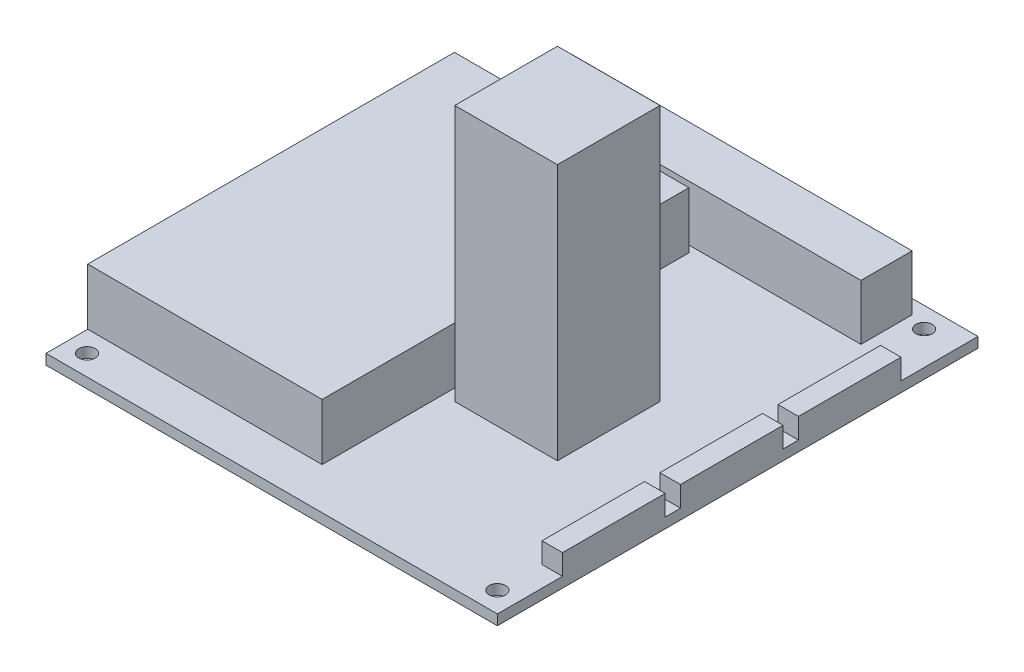
from build123d import *

# Parameters (mm, degrees)
SKETCH3_W           = 88
SKETCH3_H           = 93.7
SKETCH3_R           = 1.6
BOSS_EXTRUDE1_DEPTH = 2
SKETCH4_W           = 45.7
SKETCH4_H           = 71.5
BOSS_EXTRUDE2_DEPTH = 11
SKETCH5_W           = 66.548
SKETCH5_H           = 9.979
BOSS_EXTRUDE3_DEPTH = 10.8
SKETCH6_W           = 20
SKETCH6_H           = 20
BOSS_EXTRUDE4_DEPTH = 50
SKETCH7_W           = 4
SKETCH7_H           = 20
BOSS_EXTRUDE5_DEPTH = 4
SKETCH8_W           = 0.635
SKETCH8_H           = 0.635
BOSS_EXTRUDE6_DEPTH = 12


with BuildPart() as part:
    # Sketch3 → Boss-Extrude1 (new body)
    with BuildSketch(Plane(origin=(0, 0, 0), x_dir=(1, 0, 0), z_dir=(0, 1, 0))):
        Rectangle(SKETCH3_W, SKETCH3_H)
        with Locations(Location((-40, -42.85, 0), (0, 0, 270))):
            Circle(SKETCH3_R, mode=Mode.SUBTRACT)
        with Locations(Location((37.5, 42.85, 0), (0, 0, 270))):
            Circle(SKETCH3_R, mode=Mode.SUBTRACT)
        with Locations(Location((-36.2, 42.85, 0), (0, 0, 270))):
            Circle(SKETCH3_R, mode=Mode.SUBTRACT)
        with Locations(Location((40, -42.85, 0), (0, 0, 270))):
            Circle(SKETCH3_R, mode=Mode.SUBTRACT)
    extrude(amount=BOSS_EXTRUDE1_DEPTH)

    # Sketch4 → Boss-Extrude2 (add)
    with BuildSketch(Plane(origin=(0, 2, 0), x_dir=(1, 0, 0), z_dir=(0, 1, 0))):
        with Locations((-21.15, -2.968346533)):
            Rectangle(SKETCH4_W, SKETCH4_H)
    extrude(amount=BOSS_EXTRUDE2_DEPTH)

    # Sketch5 → Boss-Extrude3 (add)
    with BuildSketch(Plane(origin=(0, 2, 0), x_dir=(1, 0, 0), z_dir=(0, 1, 0))):
        with Locations((0.649, 39.0915)):
            Rectangle(SKETCH5_W, SKETCH5_H)
    extrude(amount=BOSS_EXTRUDE3_DEPTH)

    # Sketch6 → Boss-Extrude4 (add)
    with BuildSketch(Plane(origin=(0, 2, 0), x_dir=(1, 0, 0), z_dir=(0, 1, 0))):
        with Locations((14, -5.15)):
            Rectangle(SKETCH6_W, SKETCH6_H)
    extrude(amount=BOSS_EXTRUDE4_DEPTH)

    # Sketch7 → Boss-Extrude5 (add)
    with BuildSketch(Plane(origin=(0, 2, 0), x_dir=(1, 0, 0), z_dir=(0, 1, 0))):
        with Locations((42, 21.85)):
            Rectangle(SKETCH7_W, SKETCH7_H)
        with Locations((42, -1.15)):
            Rectangle(SKETCH7_W, SKETCH7_H)
        with Locations((42, -24.15)):
            Rectangle(SKETCH7_W, SKETCH7_H)
    extrude(amount=BOSS_EXTRUDE5_DEPTH)

    # Sketch8 → Boss-Extrude6 (add)
    with BuildSketch(Plane(origin=(0, 2, 0), x_dir=(1, 0, 0), z_dir=(0, 1, 0))):
        with Locations((-31.3545, 42.8105)):
            Rectangle(SKETCH8_W, SKETCH8_H)
        with Locations((-28.8145, 42.8105)):
            Rectangle(SKETCH8_W, SKETCH8_H)
        with Locations((-26.2745, 42.8105)):
            Rectangle(SKETCH8_W, SKETCH8_H)
        with Locations((-23.7345, 42.8105)):
            Rectangle(SKETCH8_W, SKETCH8_H)
        with Locations((-21.1945, 42.8105)):
            Rectangle(SKETCH8_W, SKETCH8_H)
        with Locations((-18.6545, 42.8105)):
            Rectangle(SKETCH8_W, SKETCH8_H)
        with Locations((-16.1145, 42.8105)):
            Rectangle(SKETCH8_W, SKETCH8_H)
        with Locations((-13.5745, 42.8105)):
            Rectangle(SKETCH8_W, SKETCH8_H)
        with Locations((-11.0345, 42.8105)):
            Rectangle(SKETCH8_W, SKETCH8_H)
        with Locations((-8.4945, 42.8105)):
            Rectangle(SKETCH8_W, SKETCH8_H)
        with Locations((-5.9545, 42.8105)):
            Rectangle(SKETCH8_W, SKETCH8_H)
        with Locations((-3.4145, 42.8105)):
            Rectangle(SKETCH8_W, SKETCH8_H)
        with Locations((-0.8745, 42.8105)):
            Rectangle(SKETCH8_W, SKETCH8_H)
        with Locations((1.6655, 42.8105)):
            Rectangle(SKETCH8_W, SKETCH8_H)
        with Locations((4.2055, 42.8105)):
            Rectangle(SKETCH8_W, SKETCH8_H)
        with Locations((6.7455, 42.8105)):
            Rectangle(SKETCH8_W, SKETCH8_H)
        with Locations((9.2855, 42.8105)):
            Rectangle(SKETCH8_W, SKETCH8_H)
        with Locations((11.8255, 42.8105)):
            Rectangle(SKETCH8_W, SKETCH8_H)
        with Locations((14.3655, 42.8105)):
            Rectangle(SKETCH8_W, SKETCH8_H)
        with Locations((16.9055, 42.8105)):
            Rectangle(SKETCH8_W, SKETCH8_H)
        with Locations((19.4455, 42.8105)):
            Rectangle(SKETCH8_W, SKETCH8_H)
        with Locations((21.9855, 42.8105)):
            Rectangle(SKETCH8_W, SKETCH8_H)
        with Locations((24.5255, 42.8105)):
            Rectangle(SKETCH8_W, SKETCH8_H)
        with Locations((27.0655, 42.8105)):
            Rectangle(SKETCH8_W, SKETCH8_H)
        with Locations((29.6055, 42.8105)):
            Rectangle(SKETCH8_W, SKETCH8_H)
        with Locations((32.1455, 42.8105)):
            Rectangle(SKETCH8_W, SKETCH8_H)
        with Locations((-28.8145, 40.2705)):
            Rectangle(SKETCH8_W, SKETCH8_H)
        with Locations((-26.2745, 40.2705)):
            Rectangle(SKETCH8_W, SKETCH8_H)
        with Locations((-23.7345, 40.2705)):
            Rectangle(SKETCH8_W, SKETCH8_H)
        with Locations((-21.1945, 40.2705)):
            Rectangle(SKETCH8_W, SKETCH8_H)
        with Locations((-18.6545, 40.2705)):
            Rectangle(SKETCH8_W, SKETCH8_H)
        with Locations((-16.1145, 40.2705)):
            Rectangle(SKETCH8_W, SKETCH8_H)
        with Locations((-13.5745, 40.2705)):
            Rectangle(SKETCH8_W, SKETCH8_H)
        with Locations((-11.0345, 40.2705)):
            Rectangle(SKETCH8_W, SKETCH8_H)
        with Locations((-8.4945, 40.2705)):
            Rectangle(SKETCH8_W, SKETCH8_H)
        with Locations((-5.9545, 40.2705)):
            Rectangle(SKETCH8_W, SKETCH8_H)
        with Locations((-3.4145, 40.2705)):
            Rectangle(SKETCH8_W, SKETCH8_H)
        with Locations((-0.8745, 40.2705)):
            Rectangle(SKETCH8_W, SKETCH8_H)
        with Locations((1.6655, 40.2705)):
            Rectangle(SKETCH8_W, SKETCH8_H)
        with Locations((4.2055, 40.2705)):
            Rectangle(SKETCH8_W, SKETCH8_H)
        with Locations((6.7455, 40.2705)):
            Rectangle(SKETCH8_W, SKETCH8_H)
        with Locations((9.2855, 40.2705)):
            Rectangle(SKETCH8_W, SKETCH8_H)
        with Locations((11.8255, 40.2705)):
            Rectangle(SKETCH8_W, SKETCH8_H)
        with Locations((14.3655, 40.2705)):
            Rectangle(SKETCH8_W, SKETCH8_H)
        with Locations((16.9055, 40.2705)):
            Rectangle(SKETCH8_W, SKETCH8_H)
        with Locations((19.4455, 40.2705)):
            Rectangle(SKETCH8_W, SKETCH8_H)
        with Locations((21.9855, 40.2705)):
            Rectangle(SKETCH8_W, SKETCH8_H)
        with Locations((24.5255, 40.2705)):
            Rectangle(SKETCH8_W, SKETCH8_H)
        with Locations((27.0655, 40.2705)):
            Rectangle(SKETCH8_W, SKETCH8_H)
        with Locations((29.6055, 40.2705)):
            Rectangle(SKETCH8_W, SKETCH8_H)
        with Locations((32.1455, 40.2705)):
            Rectangle(SKETCH8_W, SKETCH8_H)
        with Locations((-28.8145, 37.7305)):
            Rectangle(SKETCH8_W, SKETCH8_H)
        with Locations((-26.2745, 37.7305)):
            Rectangle(SKETCH8_W, SKETCH8_H)
        with Locations((-23.7345, 37.7305)):
            Rectangle(SKETCH8_W, SKETCH8_H)
        with Locations((-21.1945, 37.7305)):
            Rectangle(SKETCH8_W, SKETCH8_H)
        with Locations((-18.6545, 37.7305)):
            Rectangle(SKETCH8_W, SKETCH8_H)
        with Locations((-16.1145, 37.7305)):
            Rectangle(SKETCH8_W, SKETCH8_H)
        with Locations((-13.5745, 37.7305)):
            Rectangle(SKETCH8_W, SKETCH8_H)
        with Locations((-11.0345, 37.7305)):
            Rectangle(SKETCH8_W, SKETCH8_H)
        with Locations((-8.4945, 37.7305)):
            Rectangle(SKETCH8_W, SKETCH8_H)
        with Locations((-5.9545, 37.7305)):
            Rectangle(SKETCH8_W, SKETCH8_H)
        with Locations((-3.4145, 37.7305)):
            Rectangle(SKETCH8_W, SKETCH8_H)
        with Locations((-0.8745, 37.7305)):
            Rectangle(SKETCH8_W, SKETCH8_H)
        with Locations((1.6655, 37.7305)):
            Rectangle(SKETCH8_W, SKETCH8_H)
        with Locations((4.2055, 37.7305)):
            Rectangle(SKETCH8_W, SKETCH8_H)
        with Locations((6.7455, 37.7305)):
            Rectangle(SKETCH8_W, SKETCH8_H)
        with Locations((9.2855, 37.7305)):
            Rectangle(SKETCH8_W, SKETCH8_H)
        with Locations((11.8255, 37.7305)):
            Rectangle(SKETCH8_W, SKETCH8_H)
        with Locations((14.3655, 37.7305)):
            Rectangle(SKETCH8_W, SKETCH8_H)
        with Locations((16.9055, 37.7305)):
            Rectangle(SKETCH8_W, SKETCH8_H)
        with Locations((19.4455, 37.7305)):
            Rectangle(SKETCH8_W, SKETCH8_H)
        with Locations((21.9855, 37.7305)):
            Rectangle(SKETCH8_W, SKETCH8_H)
        with Locations((24.5255, 37.7305)):
            Rectangle(SKETCH8_W, SKETCH8_H)
        with Locations((27.0655, 37.7305)):
            Rectangle(SKETCH8_W, SKETCH8_H)
        with Locations((29.6055, 37.7305)):
            Rectangle(SKETCH8_W, SKETCH8_H)
        with Locations((32.1455, 37.7305)):
            Rectangle(SKETCH8_W, SKETCH8_H)
        with Locations((-28.8145, 35.1905)):
            Rectangle(SKETCH8_W, SKETCH8_H)
        with Locations((-26.2745, 35.1905)):
            Rectangle(SKETCH8_W, SKETCH8_H)
        with Locations((-23.7345, 35.1905)):
            Rectangle(SKETCH8_W, SKETCH8_H)
        with Locations((-21.1945, 35.1905)):
            Rectangle(SKETCH8_W, SKETCH8_H)
        with Locations((-18.6545, 35.1905)):
            Rectangle(SKETCH8_W, SKETCH8_H)
        with Locations((-16.1145, 35.1905)):
            Rectangle(SKETCH8_W, SKETCH8_H)
        with Locations((-13.5745, 35.1905)):
            Rectangle(SKETCH8_W, SKETCH8_H)
        with Locations((-11.0345, 35.1905)):
            Rectangle(SKETCH8_W, SKETCH8_H)
        with Locations((-8.4945, 35.1905)):
            Rectangle(SKETCH8_W, SKETCH8_H)
        with Locations((-5.9545, 35.1905)):
            Rectangle(SKETCH8_W, SKETCH8_H)
        with Locations((-3.4145, 35.1905)):
            Rectangle(SKETCH8_W, SKETCH8_H)
        with Locations((-0.8745, 35.1905)):
            Rectangle(SKETCH8_W, SKETCH8_H)
        with Locations((1.6655, 35.1905)):
            Rectangle(SKETCH8_W, SKETCH8_H)
        with Locations((4.2055, 35.1905)):
            Rectangle(SKETCH8_W, SKETCH8_H)
        with Locations((6.7455, 35.1905)):
            Rectangle(SKETCH8_W, SKETCH8_H)
        with Locations((9.2855, 35.1905)):
            Rectangle(SKETCH8_W, SKETCH8_H)
        with Locations((11.8255, 35.1905)):
            Rectangle(SKETCH8_W, SKETCH8_H)
        with Locations((14.3655, 35.1905)):
            Rectangle(SKETCH8_W, SKETCH8_H)
        with Locations((16.9055, 35.1905)):
            Rectangle(SKETCH8_W, SKETCH8_H)
        with Locations((19.4455, 35.1905)):
            Rectangle(SKETCH8_W, SKETCH8_H)
        with Locations((21.9855, 35.1905)):
            Rectangle(SKETCH8_W, SKETCH8_H)
        with Locations((24.5255, 35.1905)):
            Rectangle(SKETCH8_W, SKETCH8_H)
        with Locations((27.0655, 35.1905)):
            Rectangle(SKETCH8_W, SKETCH8_H)
        with Locations((29.6055, 35.1905)):
            Rectangle(SKETCH8_W, SKETCH8_H)
        with Locations((32.1455, 35.1905)):
            Rectangle(SKETCH8_W, SKETCH8_H)
        with Locations((-31.3545, 40.2705)):
            Rectangle(SKETCH8_W, SKETCH8_H)
        with Locations((-31.3545, 37.7305)):
            Rectangle(SKETCH8_W, SKETCH8_H)
        with Locations((-31.3545, 35.1905)):
            Rectangle(SKETCH8_W, SKETCH8_H)
    extrude(amount=-BOSS_EXTRUDE6_DEPTH)


solid = part.part
